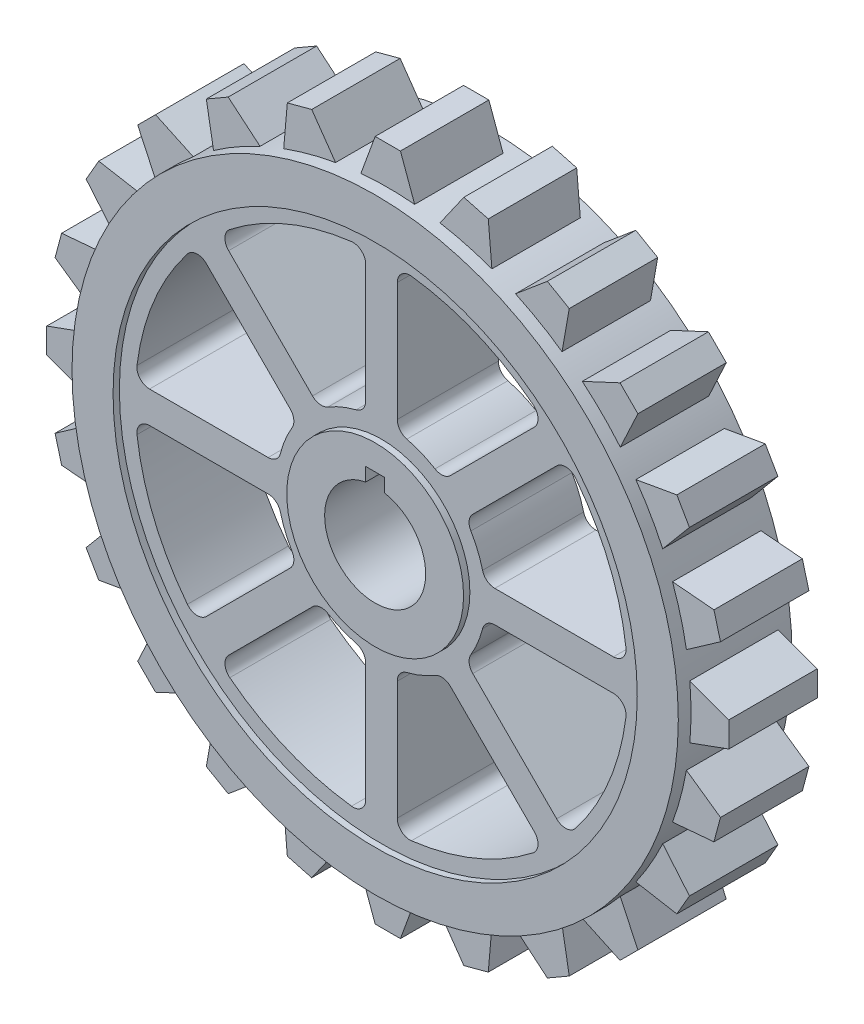
from build123d import *

# Parameters (mm, degrees)
SKETCH1_R           = 41.5
BOSS_EXTRUDE1_DEPTH = 9
BOSS_EXTRUDE2_DEPTH = 7
SKETCH1_8_R         = 41.5
BOSS_EXTRUDE3_DEPTH = 8
BOSS_EXTRUDE4_DEPTH = 9


with BuildPart() as part:
    # Sketch1 → Boss-Extrude1 (new, symmetric)
    with BuildSketch(Plane.XY):
        with BuildLine():
            ThreePointArc((4.252519055, 47.81125476), (0, 48), (-4.252519055, 47.81125476))
            ThreePointArc((-4.252519055, 47.81125476), (-6.265257227, 47.589353346), (-8.26684532, 47.282758681))
            ThreePointArc((-8.26684532, 47.282758681), (-12.423314165, 46.364439662), (-16.482081284, 45.081492838))
            ThreePointArc((-16.482081284, 45.081492838), (-18.368804754, 44.346217561), (-20.222837848, 43.532020736))
            ThreePointArc((-20.222837848, 43.532020736), (-24, 41.569219382), (-27.588416911, 39.279501681))
            ThreePointArc((-27.588416911, 39.279501681), (-29.220548592, 38.080960334), (-30.800677397, 36.814647518))
            ThreePointArc((-30.800677397, 36.814647518), (-33.941125497, 33.941125497), (-36.814647518, 30.800677397))
            ThreePointArc((-36.814647518, 30.800677397), (-38.080960334, 29.220548592), (-39.279501681, 27.588416911))
            ThreePointArc((-39.279501681, 27.588416911), (-41.569219382, 24), (-43.532020736, 20.222837848))
            ThreePointArc((-43.532020736, 20.222837848), (-44.346217561, 18.368804754), (-45.081492838, 16.482081284))
            ThreePointArc((-45.081492838, 16.482081284), (-46.364439662, 12.423314165), (-47.282758681, 8.26684532))
            ThreePointArc((-47.282758681, 8.26684532), (-47.589353346, 6.265257227), (-47.81125476, 4.252519055))
            ThreePointArc((-47.81125476, 4.252519055), (-48, 0), (-47.81125476, -4.252519055))
            ThreePointArc((-47.81125476, -4.252519055), (-47.589353346, -6.265257227), (-47.282758681, -8.26684532))
            ThreePointArc((-47.282758681, -8.26684532), (-46.364439662, -12.423314165), (-45.081492838, -16.482081284))
            ThreePointArc((-45.081492838, -16.482081284), (-44.346217561, -18.368804754), (-43.532020736, -20.222837848))
            ThreePointArc((-43.532020736, -20.222837848), (-41.569219382, -24), (-39.279501681, -27.588416911))
            ThreePointArc((-39.279501681, -27.588416911), (-38.080960334, -29.220548592), (-36.814647518, -30.800677397))
            ThreePointArc((-36.814647518, -30.800677397), (-33.941125497, -33.941125497), (-30.800677397, -36.814647518))
            ThreePointArc((-30.800677397, -36.814647518), (-29.220548592, -38.080960334), (-27.588416911, -39.279501681))
            ThreePointArc((-27.588416911, -39.279501681), (-24, -41.569219382), (-20.222837848, -43.532020736))
            ThreePointArc((-20.222837848, -43.532020736), (-18.368804754, -44.346217561), (-16.482081284, -45.081492838))
            ThreePointArc((-16.482081284, -45.081492838), (-12.423314165, -46.364439662), (-8.26684532, -47.282758681))
            ThreePointArc((-8.26684532, -47.282758681), (-6.265257227, -47.589353346), (-4.252519055, -47.81125476))
            ThreePointArc((-4.252519055, -47.81125476), (0, -48), (4.252519055, -47.81125476))
            ThreePointArc((4.252519055, -47.81125476), (6.265257227, -47.589353346), (8.26684532, -47.282758681))
            ThreePointArc((8.26684532, -47.282758681), (12.423314165, -46.364439662), (16.482081284, -45.081492838))
            ThreePointArc((16.482081284, -45.081492838), (18.368804754, -44.346217561), (20.222837848, -43.532020736))
            ThreePointArc((20.222837848, -43.532020736), (24, -41.569219382), (27.588416911, -39.279501681))
            ThreePointArc((27.588416911, -39.279501681), (29.220548592, -38.080960334), (30.800677397, -36.814647518))
            ThreePointArc((30.800677397, -36.814647518), (33.941125497, -33.941125497), (36.814647518, -30.800677397))
            ThreePointArc((36.814647518, -30.800677397), (38.080960334, -29.220548592), (39.279501681, -27.588416911))
            ThreePointArc((39.279501681, -27.588416911), (41.569219382, -24), (43.532020736, -20.222837848))
            ThreePointArc((43.532020736, -20.222837848), (44.346217561, -18.368804754), (45.081492838, -16.482081284))
            ThreePointArc((45.081492838, -16.482081284), (46.364439662, -12.423314165), (47.282758681, -8.26684532))
            ThreePointArc((47.282758681, -8.26684532), (47.589353346, -6.265257227), (47.81125476, -4.252519055))
            ThreePointArc((47.81125476, -4.252519055), (47.952790474, -2.12835283), (48, 0))
            ThreePointArc((48, 0), (47.952790474, 2.12835283), (47.81125476, 4.252519055))
            ThreePointArc((47.81125476, 4.252519055), (47.589353346, 6.265257227), (47.282758681, 8.26684532))
            ThreePointArc((47.282758681, 8.26684532), (46.364439662, 12.423314165), (45.081492838, 16.482081284))
            ThreePointArc((45.081492838, 16.482081284), (44.346217561, 18.368804754), (43.532020736, 20.222837848))
            ThreePointArc((43.532020736, 20.222837848), (41.569219382, 24), (39.279501681, 27.588416911))
            ThreePointArc((39.279501681, 27.588416911), (38.080960334, 29.220548592), (36.814647518, 30.800677397))
            ThreePointArc((36.814647518, 30.800677397), (33.941125497, 33.941125497), (30.800677397, 36.814647518))
            ThreePointArc((30.800677397, 36.814647518), (29.220548592, 38.080960334), (27.588416911, 39.279501681))
            ThreePointArc((27.588416911, 39.279501681), (24, 41.569219382), (20.222837848, 43.532020736))
            ThreePointArc((20.222837848, 43.532020736), (18.368804754, 44.346217561), (16.482081284, 45.081492838))
            ThreePointArc((16.482081284, 45.081492838), (12.423314165, 46.364439662), (8.26684532, 47.282758681))
            ThreePointArc((8.26684532, 47.282758681), (6.265257227, 47.589353346), (4.252519055, 47.81125476))
        make_face()
        Circle(SKETCH1_R, mode=Mode.SUBTRACT)
    extrude(amount=BOSS_EXTRUDE1_DEPTH, both=True)

    # Sketch1<5> → Boss-Extrude2 (add, symmetric)
    with BuildSketch(Plane.XY):
        with BuildLine():
            Line((2, 54), (-2, 54))
            Line((-2, 54), (-4.252519055, 47.81125476))
            ThreePointArc((-4.252519055, 47.81125476), (0, 48), (4.252519055, 47.81125476))
            Line((4.252519055, 47.81125476), (2, 54))
        make_face()
        with BuildLine():
            ThreePointArc((-16.482081284, 45.081492838), (-12.423314165, 46.364439662), (-8.26684532, 47.282758681))
            Line((-8.26684532, 47.282758681), (-12.044376783, 52.67763271))
            Line((-12.044376783, 52.67763271), (-15.908080088, 51.642356529))
            Line((-15.908080088, 51.642356529), (-16.482081284, 45.081492838))
        make_face()
        with BuildLine():
            Line((12.044376783, 52.67763271), (8.26684532, 47.282758681))
            ThreePointArc((8.26684532, 47.282758681), (12.423314165, 46.364439662), (16.482081284, 45.081492838))
            Line((16.482081284, 45.081492838), (15.908080088, 51.642356529))
            Line((15.908080088, 51.642356529), (12.044376783, 52.67763271))
        make_face()
        with BuildLine():
            ThreePointArc((-27.588416911, 39.279501681), (-24, 41.569219382), (-20.222837848, 43.532020736))
            Line((-20.222837848, 43.532020736), (-25.267949192, 47.765371804))
            Line((-25.267949192, 47.765371804), (-28.732050808, 45.765371804))
            Line((-28.732050808, 45.765371804), (-27.588416911, 39.279501681))
        make_face()
        with BuildLine():
            Line((25.267949192, 47.765371804), (20.222837848, 43.532020736))
            ThreePointArc((20.222837848, 43.532020736), (24, 41.569219382), (27.588416911, 39.279501681))
            Line((27.588416911, 39.279501681), (28.732050808, 45.765371804))
            Line((28.732050808, 45.765371804), (25.267949192, 47.765371804))
        make_face()
        with BuildLine():
            ThreePointArc((-36.814647518, 30.800677397), (-33.941125497, 33.941125497), (-30.800677397, 36.814647518))
            Line((-30.800677397, 36.814647518), (-36.769552622, 39.597979746))
            Line((-36.769552622, 39.597979746), (-39.597979746, 36.769552622))
            Line((-39.597979746, 36.769552622), (-36.814647518, 30.800677397))
        make_face()
        with BuildLine():
            Line((36.769552622, 39.597979746), (30.800677397, 36.814647518))
            ThreePointArc((30.800677397, 36.814647518), (33.941125497, 33.941125497), (36.814647518, 30.800677397))
            Line((36.814647518, 30.800677397), (39.597979746, 36.769552622))
            Line((39.597979746, 36.769552622), (36.769552622, 39.597979746))
        make_face()
        with BuildLine():
            ThreePointArc((-43.532020736, 20.222837848), (-41.569219382, 24), (-39.279501681, 27.588416911))
            Line((-39.279501681, 27.588416911), (-45.765371804, 28.732050808))
            Line((-45.765371804, 28.732050808), (-47.765371804, 25.267949192))
            Line((-47.765371804, 25.267949192), (-43.532020736, 20.222837848))
        make_face()
        with BuildLine():
            Line((45.765371804, 28.732050808), (39.279501681, 27.588416911))
            ThreePointArc((39.279501681, 27.588416911), (41.569219382, 24), (43.532020736, 20.222837848))
            Line((43.532020736, 20.222837848), (47.765371804, 25.267949192))
            Line((47.765371804, 25.267949192), (45.765371804, 28.732050808))
        make_face()
        with BuildLine():
            ThreePointArc((-47.282758681, 8.26684532), (-46.364439662, 12.423314165), (-45.081492838, 16.482081284))
            Line((-45.081492838, 16.482081284), (-51.642356529, 15.908080088))
            Line((-51.642356529, 15.908080088), (-52.67763271, 12.044376783))
            Line((-52.67763271, 12.044376783), (-47.282758681, 8.26684532))
        make_face()
        with BuildLine():
            Line((51.642356529, 15.908080088), (45.081492838, 16.482081284))
            ThreePointArc((45.081492838, 16.482081284), (46.364439662, 12.423314165), (47.282758681, 8.26684532))
            Line((47.282758681, 8.26684532), (52.67763271, 12.044376783))
            Line((52.67763271, 12.044376783), (51.642356529, 15.908080088))
        make_face()
        with BuildLine():
            ThreePointArc((-47.81125476, -4.252519055), (-48, 0), (-47.81125476, 4.252519055))
            Line((-47.81125476, 4.252519055), (-54, 2))
            Line((-54, 2), (-54, -2))
            Line((-54, -2), (-47.81125476, -4.252519055))
        make_face()
        with BuildLine():
            Line((54, 2), (47.81125476, 4.252519055))
            ThreePointArc((47.81125476, 4.252519055), (48, 0), (47.81125476, -4.252519055))
            Line((47.81125476, -4.252519055), (54, -2))
            Line((54, -2), (54, 2))
        make_face()
        with BuildLine():
            ThreePointArc((-45.081492838, -16.482081284), (-46.364439662, -12.423314165), (-47.282758681, -8.26684532))
            Line((-47.282758681, -8.26684532), (-52.67763271, -12.044376783))
            Line((-52.67763271, -12.044376783), (-51.642356529, -15.908080088))
            Line((-51.642356529, -15.908080088), (-45.081492838, -16.482081284))
        make_face()
        with BuildLine():
            Line((52.67763271, -12.044376783), (47.282758681, -8.26684532))
            ThreePointArc((47.282758681, -8.26684532), (46.364439662, -12.423314165), (45.081492838, -16.482081284))
            Line((45.081492838, -16.482081284), (51.642356529, -15.908080088))
            Line((51.642356529, -15.908080088), (52.67763271, -12.044376783))
        make_face()
        with BuildLine():
            ThreePointArc((-39.279501681, -27.588416911), (-41.569219382, -24), (-43.532020736, -20.222837848))
            Line((-43.532020736, -20.222837848), (-47.765371804, -25.267949192))
            Line((-47.765371804, -25.267949192), (-45.765371804, -28.732050808))
            Line((-45.765371804, -28.732050808), (-39.279501681, -27.588416911))
        make_face()
        with BuildLine():
            Line((47.765371804, -25.267949192), (43.532020736, -20.222837848))
            ThreePointArc((43.532020736, -20.222837848), (41.569219382, -24), (39.279501681, -27.588416911))
            Line((39.279501681, -27.588416911), (45.765371804, -28.732050808))
            Line((45.765371804, -28.732050808), (47.765371804, -25.267949192))
        make_face()
        with BuildLine():
            ThreePointArc((-30.800677397, -36.814647518), (-33.941125497, -33.941125497), (-36.814647518, -30.800677397))
            Line((-36.814647518, -30.800677397), (-39.597979746, -36.769552622))
            Line((-39.597979746, -36.769552622), (-36.769552622, -39.597979746))
            Line((-36.769552622, -39.597979746), (-30.800677397, -36.814647518))
        make_face()
        with BuildLine():
            Line((39.597979746, -36.769552622), (36.814647518, -30.800677397))
            ThreePointArc((36.814647518, -30.800677397), (33.941125497, -33.941125497), (30.800677397, -36.814647518))
            Line((30.800677397, -36.814647518), (36.769552622, -39.597979746))
            Line((36.769552622, -39.597979746), (39.597979746, -36.769552622))
        make_face()
        with BuildLine():
            ThreePointArc((-20.222837848, -43.532020736), (-24, -41.569219382), (-27.588416911, -39.279501681))
            Line((-27.588416911, -39.279501681), (-28.732050808, -45.765371804))
            Line((-28.732050808, -45.765371804), (-25.267949192, -47.765371804))
            Line((-25.267949192, -47.765371804), (-20.222837848, -43.532020736))
        make_face()
        with BuildLine():
            Line((28.732050808, -45.765371804), (27.588416911, -39.279501681))
            ThreePointArc((27.588416911, -39.279501681), (24, -41.569219382), (20.222837848, -43.532020736))
            Line((20.222837848, -43.532020736), (25.267949192, -47.765371804))
            Line((25.267949192, -47.765371804), (28.732050808, -45.765371804))
        make_face()
        with BuildLine():
            ThreePointArc((-8.26684532, -47.282758681), (-12.423314165, -46.364439662), (-16.482081284, -45.081492838))
            Line((-16.482081284, -45.081492838), (-15.908080088, -51.642356529))
            Line((-15.908080088, -51.642356529), (-12.044376783, -52.67763271))
            Line((-12.044376783, -52.67763271), (-8.26684532, -47.282758681))
        make_face()
        with BuildLine():
            Line((15.908080088, -51.642356529), (16.482081284, -45.081492838))
            ThreePointArc((16.482081284, -45.081492838), (12.423314165, -46.364439662), (8.26684532, -47.282758681))
            Line((8.26684532, -47.282758681), (12.044376783, -52.67763271))
            Line((12.044376783, -52.67763271), (15.908080088, -51.642356529))
        make_face()
        with BuildLine():
            ThreePointArc((4.252519055, -47.81125476), (0, -48), (-4.252519055, -47.81125476))
            Line((-4.252519055, -47.81125476), (-2, -54))
            Line((-2, -54), (2, -54))
            Line((2, -54), (4.252519055, -47.81125476))
        make_face()
    extrude(amount=BOSS_EXTRUDE2_DEPTH, both=True)

    # Sketch1<8> → Boss-Extrude3 (add, symmetric)
    with BuildSketch(Plane.XY):
        Circle(SKETCH1_8_R)
        with BuildLine():
            Line((-2.5, -17.944358445), (-2.5, -36.725331857))
            ThreePointArc((-2.5, -36.725331857), (-3.174572991, -38.223077911), (-4.743243243, -38.71048493))
            ThreePointArc((-4.743243243, -38.71048493), (-14.924653862, -36.031301768), (-24.018466935, -30.726425859))
            ThreePointArc((-24.018466935, -30.726425859), (-24.7830355, -29.272559678), (-24.200964244, -27.73649815))
            Line((-24.200964244, -27.73649815), (-10.920810587, -14.456344493))
            ThreePointArc((-10.920810587, -14.456344493), (-9.751687534, -13.885632203), (-8.478856806, -14.15482205))
            ThreePointArc((-8.478856806, -14.15482205), (-6.314276634, -15.244012286), (-4.013513514, -16.004427802))
            ThreePointArc((-4.013513514, -16.004427802), (-2.923140309, -16.714109074), (-2.5, -17.944358445))
        make_face(mode=Mode.SUBTRACT)
        with BuildLine():
            Line((-14.456344493, -10.920810587), (-27.73649815, -24.200964244))
            ThreePointArc((-27.73649815, -24.200964244), (-29.272559678, -24.7830355), (-30.726425859, -24.018466935))
            ThreePointArc((-30.726425859, -24.018466935), (-36.031301768, -14.924653862), (-38.71048493, -4.743243243))
            ThreePointArc((-38.71048493, -4.743243243), (-38.223077911, -3.174572991), (-36.725331857, -2.5))
            Line((-36.725331857, -2.5), (-17.944358445, -2.5))
            ThreePointArc((-17.944358445, -2.5), (-16.714109074, -2.923140309), (-16.004427802, -4.013513514))
            ThreePointArc((-16.004427802, -4.013513514), (-15.244012286, -6.314276634), (-14.15482205, -8.478856806))
            ThreePointArc((-14.15482205, -8.478856806), (-13.885632203, -9.751687534), (-14.456344493, -10.920810587))
        make_face(mode=Mode.SUBTRACT)
        with BuildLine():
            Line((10.920810587, -14.456344493), (24.200964244, -27.73649815))
            ThreePointArc((24.200964244, -27.73649815), (24.7830355, -29.272559678), (24.018466935, -30.726425859))
            ThreePointArc((24.018466935, -30.726425859), (14.924653862, -36.031301768), (4.743243243, -38.71048493))
            ThreePointArc((4.743243243, -38.71048493), (3.174572991, -38.223077911), (2.5, -36.725331857))
            Line((2.5, -36.725331857), (2.5, -17.944358445))
            ThreePointArc((2.5, -17.944358445), (2.923140309, -16.714109074), (4.013513514, -16.004427802))
            ThreePointArc((4.013513514, -16.004427802), (6.314276634, -15.244012286), (8.478856806, -14.15482205))
            ThreePointArc((8.478856806, -14.15482205), (9.751687534, -13.885632203), (10.920810587, -14.456344493))
        make_face(mode=Mode.SUBTRACT)
        with BuildLine():
            Line((17.944358445, -2.5), (36.725331857, -2.5))
            ThreePointArc((36.725331857, -2.5), (38.223077911, -3.174572991), (38.71048493, -4.743243243))
            ThreePointArc((38.71048493, -4.743243243), (36.031301768, -14.924653862), (30.726425859, -24.018466935))
            ThreePointArc((30.726425859, -24.018466935), (29.272559678, -24.7830355), (27.73649815, -24.200964244))
            Line((27.73649815, -24.200964244), (14.456344493, -10.920810587))
            ThreePointArc((14.456344493, -10.920810587), (13.885632203, -9.751687534), (14.15482205, -8.478856806))
            ThreePointArc((14.15482205, -8.478856806), (15.244012286, -6.314276634), (16.004427802, -4.013513514))
            ThreePointArc((16.004427802, -4.013513514), (16.714109074, -2.923140309), (17.944358445, -2.5))
        make_face(mode=Mode.SUBTRACT)
        with BuildLine():
            Line((-17.944358445, 2.5), (-36.725331857, 2.5))
            ThreePointArc((-36.725331857, 2.5), (-38.223077911, 3.174572991), (-38.71048493, 4.743243243))
            ThreePointArc((-38.71048493, 4.743243243), (-36.031301768, 14.924653862), (-30.726425859, 24.018466935))
            ThreePointArc((-30.726425859, 24.018466935), (-29.272559678, 24.7830355), (-27.73649815, 24.200964244))
            Line((-27.73649815, 24.200964244), (-14.456344493, 10.920810587))
            ThreePointArc((-14.456344493, 10.920810587), (-13.885632203, 9.751687534), (-14.15482205, 8.478856806))
            ThreePointArc((-14.15482205, 8.478856806), (-15.244012286, 6.314276634), (-16.004427802, 4.013513514))
            ThreePointArc((-16.004427802, 4.013513514), (-16.714109074, 2.923140309), (-17.944358445, 2.5))
        make_face(mode=Mode.SUBTRACT)
        with BuildLine():
            ThreePointArc((-4.743243243, 38.71048493), (-3.174572991, 38.223077911), (-2.5, 36.725331857))
            Line((-2.5, 36.725331857), (-2.5, 17.944358445))
            ThreePointArc((-2.5, 17.944358445), (-2.923140309, 16.714109074), (-4.013513514, 16.004427802))
            ThreePointArc((-4.013513514, 16.004427802), (-6.314276634, 15.244012286), (-8.478856806, 14.15482205))
            ThreePointArc((-8.478856806, 14.15482205), (-9.751687534, 13.885632203), (-10.920810587, 14.456344493))
            Line((-10.920810587, 14.456344493), (-24.200964244, 27.73649815))
            ThreePointArc((-24.200964244, 27.73649815), (-24.7830355, 29.272559678), (-24.018466935, 30.726425859))
            ThreePointArc((-24.018466935, 30.726425859), (-14.924653862, 36.031301768), (-4.743243243, 38.71048493))
        make_face(mode=Mode.SUBTRACT)
        with BuildLine():
            ThreePointArc((14, 0), (-9.899494937, -9.899494937), (0, 14))
            ThreePointArc((0, 14), (9.899494937, 9.899494937), (14, 0))
        make_face(mode=Mode.SUBTRACT)
        with BuildLine():
            ThreePointArc((38.71048493, 4.743243243), (38.223077911, 3.174572991), (36.725331857, 2.5))
            Line((36.725331857, 2.5), (17.944358445, 2.5))
            ThreePointArc((17.944358445, 2.5), (16.714109074, 2.923140309), (16.004427802, 4.013513514))
            ThreePointArc((16.004427802, 4.013513514), (15.244012286, 6.314276634), (14.15482205, 8.478856806))
            ThreePointArc((14.15482205, 8.478856806), (13.885632203, 9.751687534), (14.456344493, 10.920810587))
            Line((14.456344493, 10.920810587), (27.73649815, 24.200964244))
            ThreePointArc((27.73649815, 24.200964244), (29.272559678, 24.7830355), (30.726425859, 24.018466935))
            ThreePointArc((30.726425859, 24.018466935), (36.031301768, 14.924653862), (38.71048493, 4.743243243))
        make_face(mode=Mode.SUBTRACT)
        with BuildLine():
            ThreePointArc((24.018466935, 30.726425859), (24.7830355, 29.272559678), (24.200964244, 27.73649815))
            Line((24.200964244, 27.73649815), (10.920810587, 14.456344493))
            ThreePointArc((10.920810587, 14.456344493), (9.751687534, 13.885632203), (8.478856806, 14.15482205))
            ThreePointArc((8.478856806, 14.15482205), (6.314276634, 15.244012286), (4.013513514, 16.004427802))
            ThreePointArc((4.013513514, 16.004427802), (2.923140309, 16.714109074), (2.5, 17.944358445))
            Line((2.5, 17.944358445), (2.5, 36.725331857))
            ThreePointArc((2.5, 36.725331857), (3.174572991, 38.223077911), (4.743243243, 38.71048493))
            ThreePointArc((4.743243243, 38.71048493), (14.924653862, 36.031301768), (24.018466935, 30.726425859))
        make_face(mode=Mode.SUBTRACT)
    extrude(amount=BOSS_EXTRUDE3_DEPTH, both=True)

    # Sketch1<9> → Boss-Extrude4 (add, symmetric)
    with BuildSketch(Plane.XY):
        with BuildLine():
            ThreePointArc((14, 0), (9.899494937, 9.899494937), (0, 14))
            ThreePointArc((0, 14), (-9.899494937, -9.899494937), (14, 0))
        make_face()
        with BuildLine():
            Line((-1.5, 7.858116823), (-1.5, 10))
            Line((-1.5, 10), (0, 10))
            Line((0, 10), (1.5, 10))
            Line((1.5, 10), (1.5, 7.858116823))
            ThreePointArc((1.5, 7.858116823), (0, -8), (-1.5, 7.858116823))
        make_face(mode=Mode.SUBTRACT)
    extrude(amount=BOSS_EXTRUDE4_DEPTH, both=True)


solid = part.part
